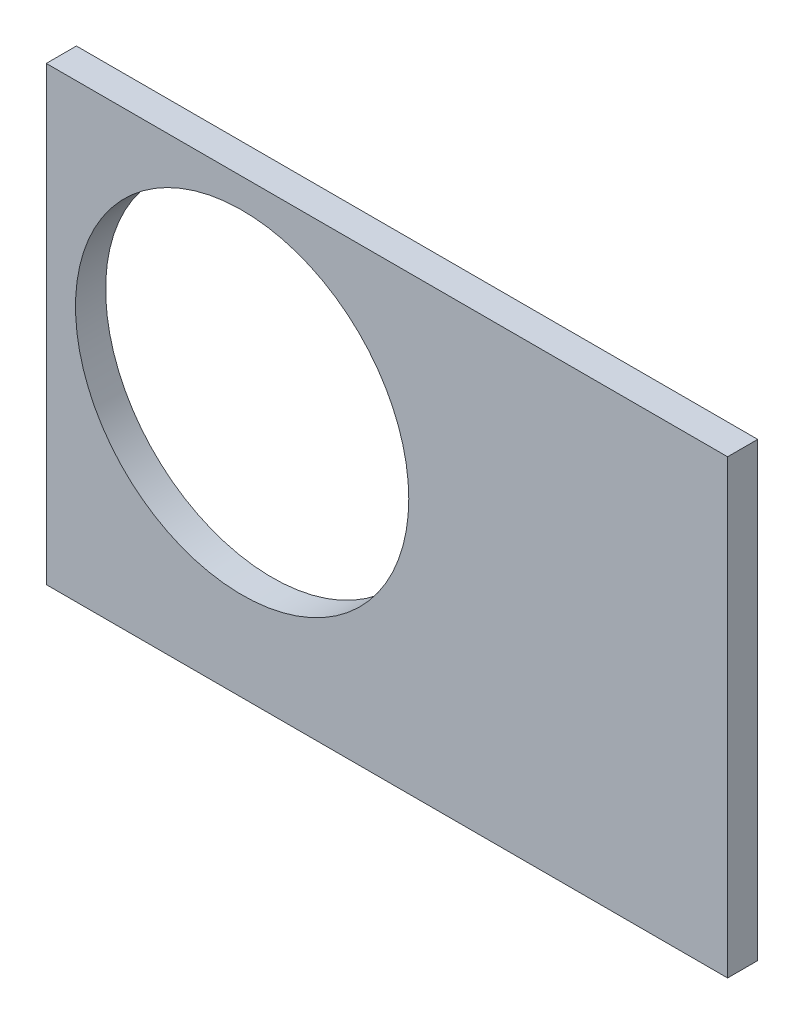
from build123d import *

# Parameters (mm, degrees)
SKETCH1_W           = 143.5735
SKETCH1_H           = 95.123
SKETCH1_R           = 35.1155
BOSS_EXTRUDE1_DEPTH = 6.35


with BuildPart() as part:
    # Sketch1 → Boss-Extrude1 (new body)
    with BuildSketch(Plane.XY):
        with Locations((30.51175, -6.2865)):
            Rectangle(SKETCH1_W, SKETCH1_H)
        Circle(SKETCH1_R, mode=Mode.SUBTRACT)
    extrude(amount=-BOSS_EXTRUDE1_DEPTH)


solid = part.part
